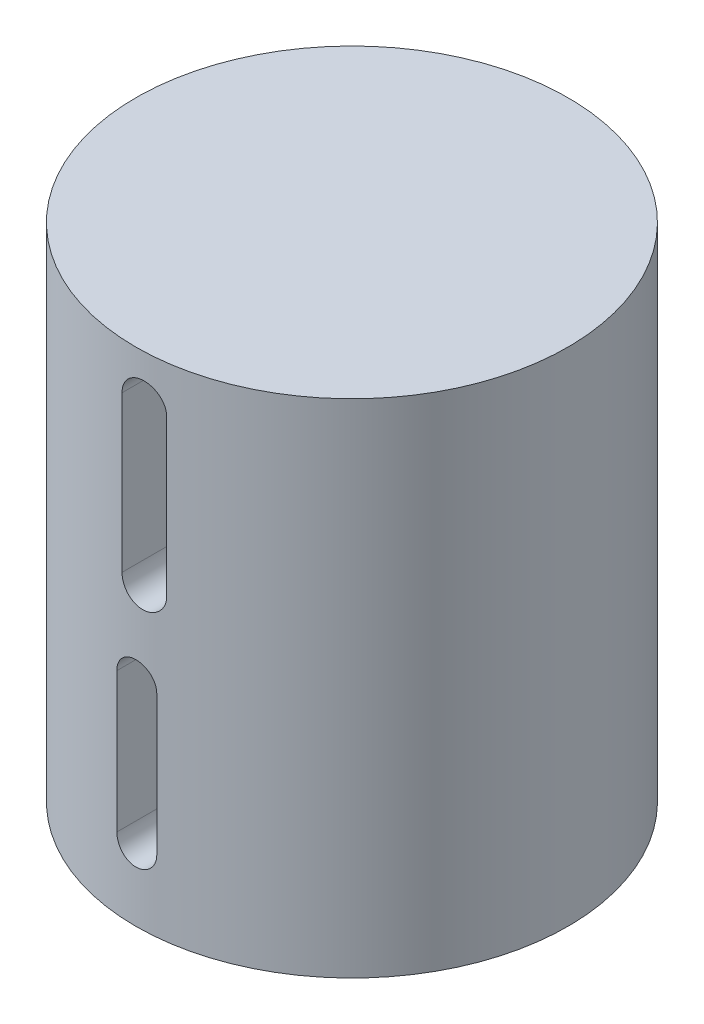
from build123d import *

# Parameters (mm, degrees)
SKETCH_3_R          = 27.991716744
EXTRUDE_1_DEPTH     = 65
CUT_EXTRUDE_1_DEPTH = 27
CUT_EXTRUDE_3_DEPTH = 50


with BuildPart() as part:
    # 草图3 → 凸台-拉伸1 (new body)
    with BuildSketch(Plane(origin=(0, 10, 0), x_dir=(1, 0, 0), z_dir=(0, 1, 0))):
        with Locations(Location((0, 0, 0), (0, 0, 270))):
            Circle(SKETCH_3_R)
    extrude(amount=EXTRUDE_1_DEPTH)

    # 草图4 → 切除-拉伸1 (cut)
    with BuildSketch(Plane.XY.offset(27.991716744)):
        with BuildLine():
            Line((3.744449093, 68.91896185), (3.744449093, 48.768976801))
            ThreePointArc((3.744449093, 48.768976801), (0.942846894, 45.967374602), (-1.858755305, 48.768976801))
            Line((-1.858755305, 48.768976801), (-1.858755305, 68.91896185))
            ThreePointArc((-1.858755305, 68.91896185), (0.942846894, 71.720564049), (3.744449093, 68.91896185))
        make_face()
    extrude(amount=-CUT_EXTRUDE_1_DEPTH, mode=Mode.SUBTRACT)

    # 草图6 → 切除-拉伸3 (cut)
    with BuildSketch(Plane.XY):
        with BuildLine():
            Line((2.586094338, 37.347060143), (2.586094338, 19.244399778))
            ThreePointArc((2.586094338, 19.244399778), (0, 16.658305441), (-2.586094338, 19.244399778))
            Line((-2.586094338, 19.244399778), (-2.586094338, 37.347060143))
            ThreePointArc((-2.586094338, 37.347060143), (0, 39.933154481), (2.586094338, 37.347060143))
        make_face()
    extrude(amount=CUT_EXTRUDE_3_DEPTH, mode=Mode.SUBTRACT)


solid = part.part
